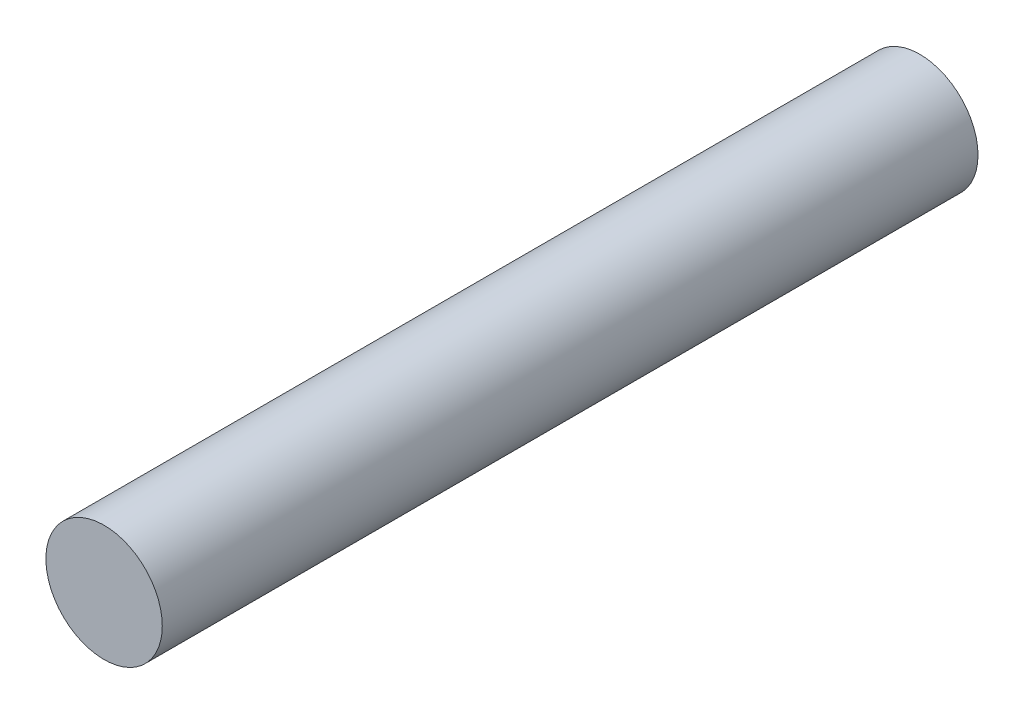
from build123d import *

# Parameters (mm, degrees)
SKETCH1_R           = 14.478
BOSS_EXTRUDE1_DEPTH = 202.946


with BuildPart() as part:
    # Sketch1 → Boss-Extrude1 (new body)
    with BuildSketch(Plane.XY):
        Circle(SKETCH1_R)
    extrude(amount=BOSS_EXTRUDE1_DEPTH)


solid = part.part
